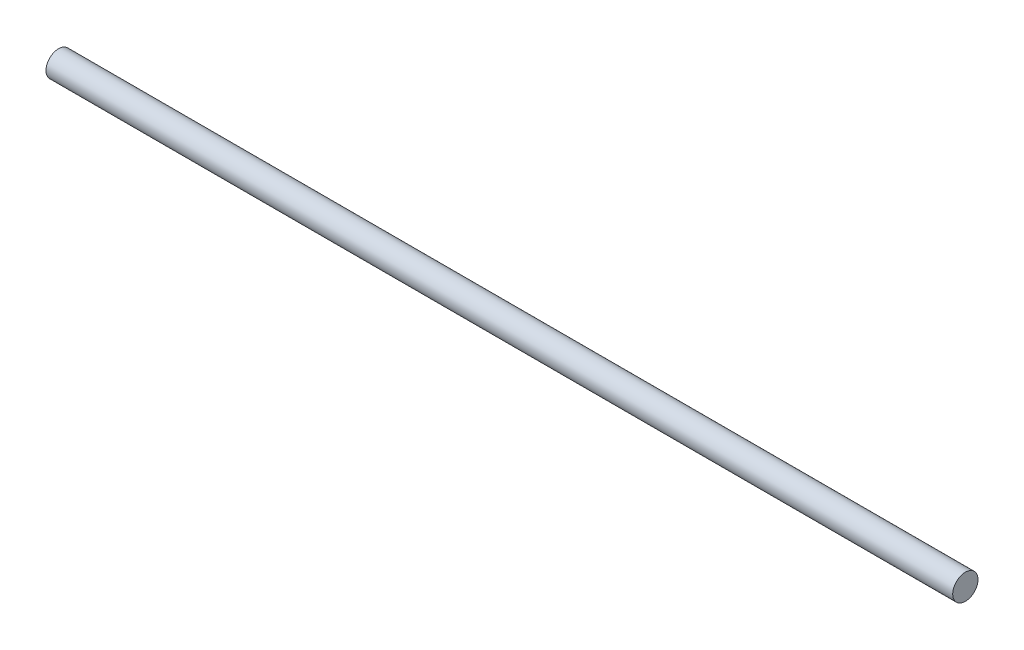
from build123d import *

# Parameters (mm, degrees)
BOSS_EXTRUDE1_DEPTH      = 26
BOSS_EXTRUDE1_DEPTH_BACK = 26
SKETCH1_R                = 0.725


with BuildPart() as part:
    # Sketch1 → Boss-Extrude1 (new, two sides: drawn at the far end of the back side and taken through both)
    with BuildSketch(Plane(origin=(0, 0, 0), x_dir=(0, 0, -1), z_dir=(1, 0, 0)).offset(-BOSS_EXTRUDE1_DEPTH_BACK)):
        Circle(SKETCH1_R)
    extrude(amount=BOSS_EXTRUDE1_DEPTH + BOSS_EXTRUDE1_DEPTH_BACK)


solid = part.part
